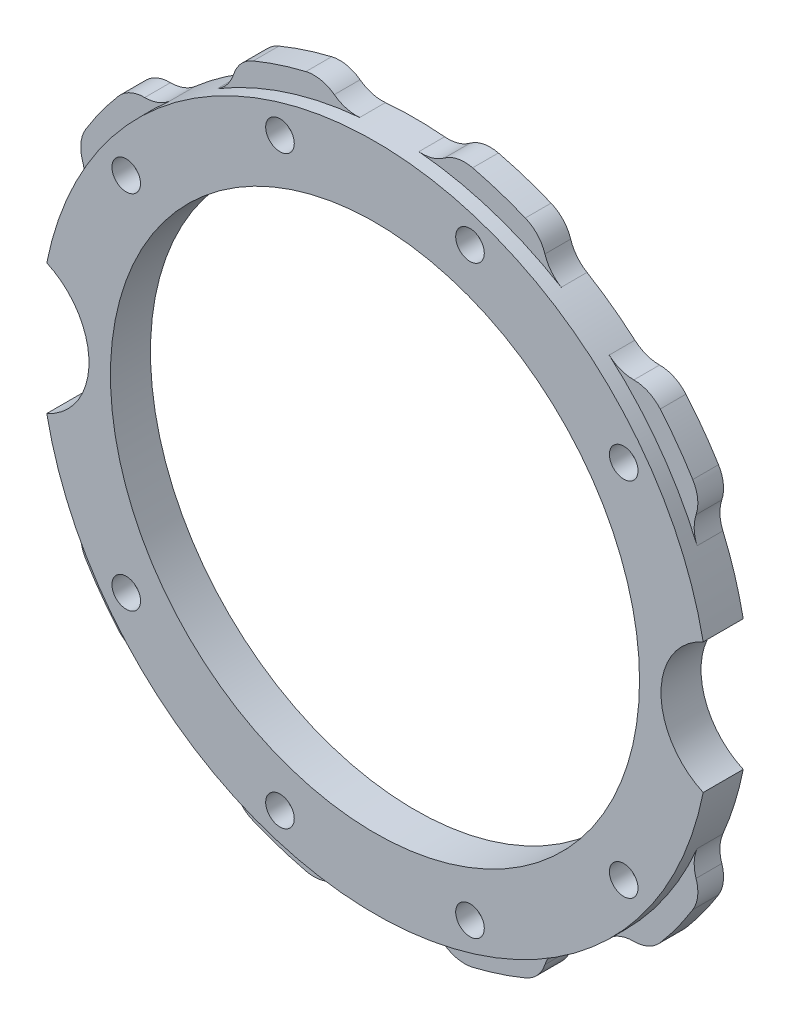
from build123d import *

# Parameters (mm, degrees)
SKIZZE1_R                       = 18.5
LINEAR_AUSTRAGEN1_DEPTH         = 1.8
SKIZZE2_R                       = 23.4
SKIZZE2_R_2                     = 18.5
LINEAR_AUSTRAGEN2_DEPTH         = 1
SKIZZE3_R                       = 1
SCHNITT_LINEAR_AUSTRAGEN1_DEPTH = 34.832857329
CHAMFER1_SIZE                   = 1.4
SKETCH1_R                       = 5
CUT_EXTRUDE1_DEPTH              = 10


with BuildPart() as part:
    # Skizze1 → Linear austragen1 (new body)
    with BuildSketch(Plane.XY):
        with BuildLine():
            ThreePointArc((-22.806936421, 5.234849671), (-23.4, 0), (-22.806936421, -5.234849671))
            ThreePointArc((-22.806936421, -5.234849671), (-22.254722481, -7.230997668), (-21.528166589, -9.170498531))
            ThreePointArc((-21.528166589, -9.170498531), (-21.322328126, -10.083900652), (-21.453393631, -11.010990043))
            ThreePointArc((-21.453393631, -11.010990043), (-21.560643818, -12.043510102), (-21.221833257, -13.024737741))
            ThreePointArc((-21.221833257, -13.024737741), (-20.14452316, -14.635852782), (-18.94516883, -16.158297497))
            ThreePointArc((-18.94516883, -16.158297497), (-18.116664111, -16.783741505), (-17.10153705, -17.000806761))
            ThreePointArc((-17.10153705, -17.000806761), (-16.179321175, -17.162642436), (-15.37423172, -17.640663225))
            ThreePointArc((-15.37423172, -17.640663225), (-13.754174904, -18.930997668), (-12.026368835, -20.073027989))
            ThreePointArc((-12.026368835, -20.073027989), (-11.322957725, -20.690997014), (-10.884062474, -21.518066457))
            ThreePointArc((-10.884062474, -21.518066457), (-10.363929634, -22.416432811), (-9.513074997, -23.011114795))
            ThreePointArc((-9.513074997, -23.011114795), (-7.69452316, -23.681307256), (-5.829354574, -24.208028116))
            ThreePointArc((-5.829354574, -24.208028116), (-4.791453413, -24.227040092), (-3.842610612, -23.805972857))
            ThreePointArc((-3.842610612, -23.805972857), (-3.001397674, -23.394835778), (-2.069093052, -23.308343012))
            ThreePointArc((-2.069093052, -23.308343012), (0, -23.4), (2.069093052, -23.308343012))
            ThreePointArc((2.069093052, -23.308343012), (3.001397674, -23.394835778), (3.842610612, -23.805972857))
            ThreePointArc((3.842610612, -23.805972857), (4.791453413, -24.227040092), (5.829354574, -24.208028116))
            ThreePointArc((5.829354574, -24.208028116), (7.69452316, -23.681307256), (9.513074997, -23.011114795))
            ThreePointArc((9.513074997, -23.011114795), (10.363929634, -22.416432811), (10.884062474, -21.518066457))
            ThreePointArc((10.884062474, -21.518066457), (11.322957725, -20.690997014), (12.026368835, -20.073027989))
            ThreePointArc((12.026368835, -20.073027989), (13.754174904, -18.930997668), (15.37423172, -17.640663225))
            ThreePointArc((15.37423172, -17.640663225), (16.179321175, -17.162642436), (17.10153705, -17.000806761))
            ThreePointArc((17.10153705, -17.000806761), (18.116664111, -16.783741505), (18.94516883, -16.158297497))
            ThreePointArc((18.94516883, -16.158297497), (20.14452316, -14.635852782), (21.221833257, -13.024737741))
            ThreePointArc((21.221833257, -13.024737741), (21.560643818, -12.043510102), (21.453393631, -11.010990043))
            ThreePointArc((21.453393631, -11.010990043), (21.322328126, -10.083900652), (21.528166589, -9.170498531))
            ThreePointArc((21.528166589, -9.170498531), (22.254722481, -7.230997668), (22.806936421, -5.234849671))
            ThreePointArc((22.806936421, -5.234849671), (23.4, 0), (22.806936421, 5.234849671))
            ThreePointArc((22.806936421, 5.234849671), (22.254722481, 7.230997668), (21.528166589, 9.170498531))
            ThreePointArc((21.528166589, 9.170498531), (21.322328126, 10.083900652), (21.453393631, 11.010990043))
            ThreePointArc((21.453393631, 11.010990043), (21.560643818, 12.043510102), (21.221833257, 13.024737741))
            ThreePointArc((21.221833257, 13.024737741), (20.14452316, 14.635852782), (18.94516883, 16.158297497))
            ThreePointArc((18.94516883, 16.158297497), (18.116664111, 16.783741505), (17.10153705, 17.000806761))
            ThreePointArc((17.10153705, 17.000806761), (16.179321175, 17.162642436), (15.37423172, 17.640663225))
            ThreePointArc((15.37423172, 17.640663225), (13.754174904, 18.930997668), (12.026368835, 20.073027989))
            ThreePointArc((12.026368835, 20.073027989), (11.322957725, 20.690997014), (10.884062474, 21.518066457))
            ThreePointArc((10.884062474, 21.518066457), (10.363929634, 22.416432811), (9.513074997, 23.011114795))
            ThreePointArc((9.513074997, 23.011114795), (7.69452316, 23.681307256), (5.829354574, 24.208028116))
            ThreePointArc((5.829354574, 24.208028116), (4.791453413, 24.227040092), (3.842610612, 23.805972857))
            ThreePointArc((3.842610612, 23.805972857), (3.001397674, 23.394835778), (2.069093052, 23.308343012))
            ThreePointArc((2.069093052, 23.308343012), (0, 23.4), (-2.069093052, 23.308343012))
            ThreePointArc((-2.069093052, 23.308343012), (-3.001397674, 23.394835778), (-3.842610612, 23.805972857))
            ThreePointArc((-3.842610612, 23.805972857), (-4.791453413, 24.227040092), (-5.829354574, 24.208028116))
            ThreePointArc((-5.829354574, 24.208028116), (-7.69452316, 23.681307256), (-9.513074997, 23.011114795))
            ThreePointArc((-9.513074997, 23.011114795), (-10.363929634, 22.416432811), (-10.884062474, 21.518066457))
            ThreePointArc((-10.884062474, 21.518066457), (-11.322957725, 20.690997014), (-12.026368835, 20.073027989))
            ThreePointArc((-12.026368835, 20.073027989), (-13.754174904, 18.930997668), (-15.37423172, 17.640663225))
            ThreePointArc((-15.37423172, 17.640663225), (-16.179321175, 17.162642436), (-17.10153705, 17.000806761))
            ThreePointArc((-17.10153705, 17.000806761), (-18.116664111, 16.783741505), (-18.94516883, 16.158297497))
            ThreePointArc((-18.94516883, 16.158297497), (-20.14452316, 14.635852782), (-21.221833257, 13.024737741))
            ThreePointArc((-21.221833257, 13.024737741), (-21.560643818, 12.043510102), (-21.453393631, 11.010990043))
            ThreePointArc((-21.453393631, 11.010990043), (-21.322328126, 10.083900652), (-21.528166589, 9.170498531))
            ThreePointArc((-21.528166589, 9.170498531), (-22.254722481, 7.230997668), (-22.806936421, 5.234849671))
        make_face()
        Circle(SKIZZE1_R, mode=Mode.SUBTRACT)
    extrude(amount=LINEAR_AUSTRAGEN1_DEPTH)

    # Skizze2 → Linear austragen2 (add)
    with BuildSketch(Plane.XY.offset(1.8)):
        with Locations(Location((0, 0, 0), (0, 0, 156.927122734))):
            Circle(SKIZZE2_R)
        Circle(SKIZZE2_R_2, mode=Mode.SUBTRACT)
    extrude(amount=LINEAR_AUSTRAGEN2_DEPTH)

    # Skizze3 → Schnitt-Linear austragen1 (cut, through all)
    with BuildSketch(Plane.XY.offset(2.8)):
        with Locations((-6.643865379, 20.4477151)):
            Circle(SKIZZE3_R)
        with Locations((6.643865379, 20.4477151)):
            Circle(SKIZZE3_R)
        with Locations((17.393865379, 12.637382924)):
            Circle(SKIZZE3_R)
        with Locations((17.393865379, -12.637382924)):
            Circle(SKIZZE3_R)
        with Locations((6.643865379, -20.4477151)):
            Circle(SKIZZE3_R)
        with Locations((-6.643865379, -20.4477151)):
            Circle(SKIZZE3_R)
        with Locations((-17.393865379, -12.637382924)):
            Circle(SKIZZE3_R)
        with Locations((-17.393865379, 12.637382924)):
            Circle(SKIZZE3_R)
    extrude(amount=-SCHNITT_LINEAR_AUSTRAGEN1_DEPTH, mode=Mode.SUBTRACT)

    # Chamfer1
    chamfer1_edges = [part.edges().sort_by_distance(p)[0] for p in [
        (-7.643865379, 20.4477151, 0),
        (5.643865379, 20.4477151, 0),
        (16.393865379, 12.637382924, 0),
        (16.393865379, -12.637382924, 0),
        (5.643865379, -20.4477151, 0),
        (-7.643865379, -20.4477151, 0),
        (-18.393865379, -12.637382924, 0),
        (-18.393865379, 12.637382924, 0),
    ]]
    chamfer(chamfer1_edges, length=CHAMFER1_SIZE)

    # Sketch1 → Cut-Extrude1 (cut)
    with BuildSketch(Plane(origin=(0, 0, 0), x_dir=(-1, 0, 0), z_dir=(0, 0, -1))):
        with Locations((-25, 0)):
            Circle(SKETCH1_R)
        with Locations((25, 0)):
            Circle(SKETCH1_R)
    extrude(amount=-CUT_EXTRUDE1_DEPTH, mode=Mode.SUBTRACT)


solid = part.part
